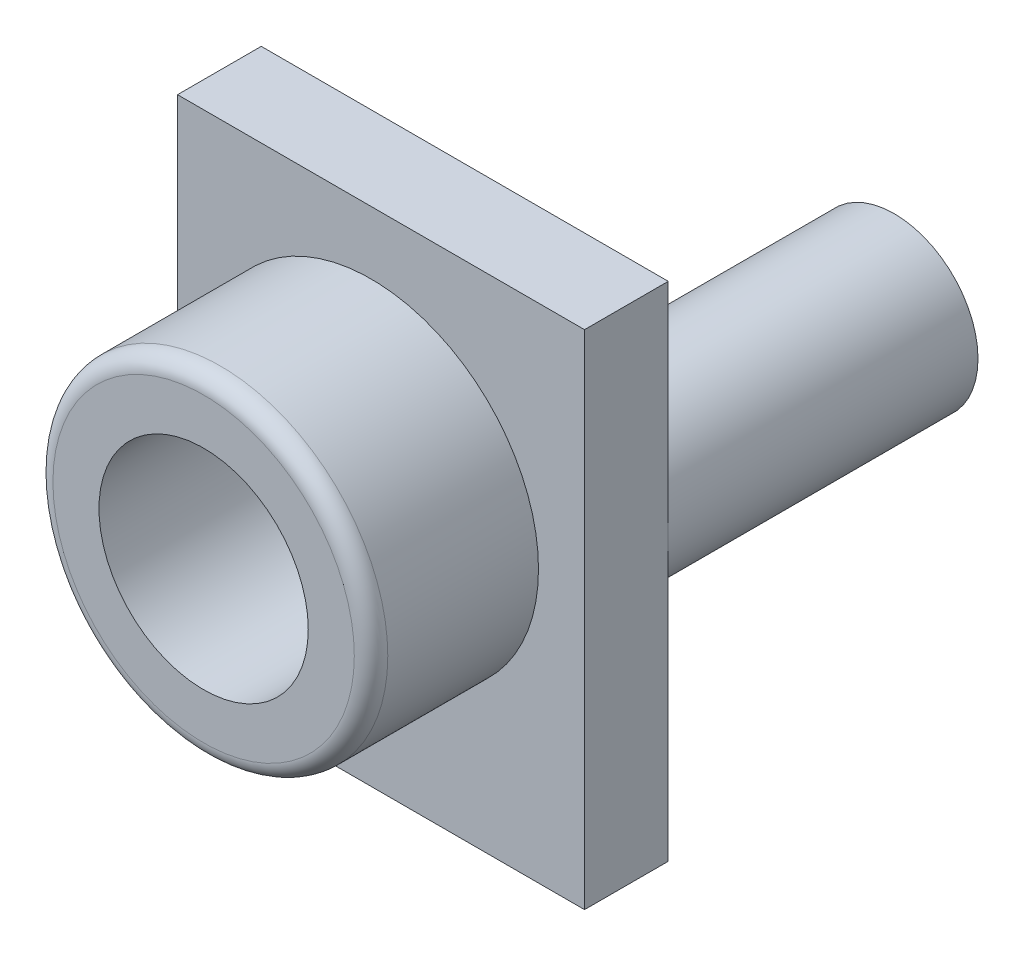
from build123d import *

# Parameters (mm, degrees)
SKETCH_2_W      = 9.723167254
SKETCH_2_H      = 12
EXTRUDE_1_DEPTH = 2
SKETCH_3_R      = 4
SKETCH_3_R_2    = 2.5
EXTRUDE_2_DEPTH = 4
SKETCH_4_R      = 2
EXTRUDE_3_DEPTH = 7.4
FILLET_1_R      = 0.4


with BuildPart() as part:
    # Эскиз2 → Бобышка-Вытянуть1 (new body)
    with BuildSketch(Plane.XY):
        Rectangle(SKETCH_2_W, SKETCH_2_H)
    extrude(amount=EXTRUDE_1_DEPTH)

    # Эскиз3 → Бобышка-Вытянуть2 (add)
    with BuildSketch(Plane.XY.offset(2)):
        with Locations((-0.238416373, 0.5)):
            Circle(SKETCH_3_R)
        with Locations((-0.238416373, 0.5)):
            Circle(SKETCH_3_R_2, mode=Mode.SUBTRACT)
    extrude(amount=EXTRUDE_2_DEPTH)

    # Эскиз4 → Бобышка-Вытянуть3 (add)
    with BuildSketch(Plane(origin=(0, 0, 0), x_dir=(-1, 0, 0), z_dir=(0, 0, -1))):
        with Locations(Location((-2.861583627, 0.7, 0), (0, 0, 180))):
            Circle(SKETCH_4_R)
    extrude(amount=EXTRUDE_3_DEPTH)

    # Скругление1
    fillet_1_edges = [part.edges().sort_by_distance(p)[0] for p in [
        (-4.238416373, 0.5, 6),
    ]]
    fillet(fillet_1_edges, radius=FILLET_1_R)


solid = part.part
